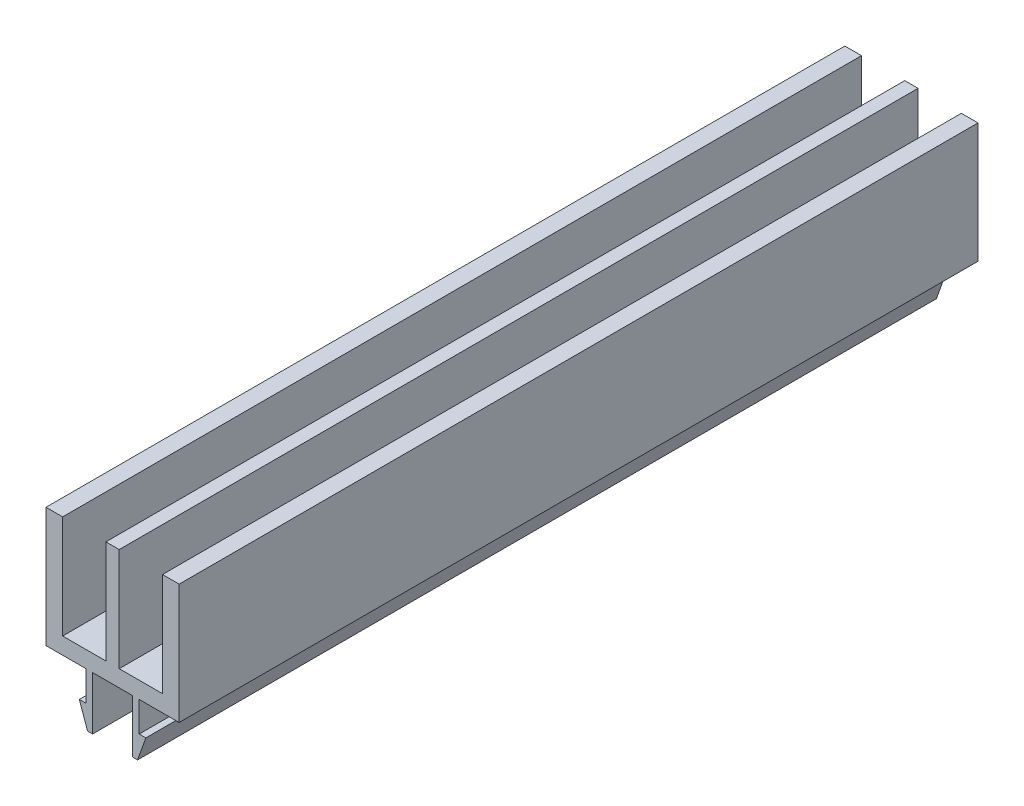
from build123d import *

# Parameters (mm, degrees)
BOSS_EXTRU_1_DEPTH = 120


with BuildPart() as part:
    # Esquisse1 → Boss.-Extru.1 (new body)
    with BuildSketch(Plane.XY.offset(50)):
        Polygon((-1, 2.5), (-7.5, 2.5), (-7.5, 17.999999998), (-10, 17.999999998), (-10, 0), (-4, 0), (-4, -4.5), (-5, -4.5), (-3.75, -8), (-3, -8), (-3, 0), (3, 0), (3, -8), (3.75, -8), (5, -4.5), (4, -4.5), (4, 0), (10, 0), (10, 17.999999998), (7.5, 17.999999998), (7.5, 2.5), (1, 2.5), (1, 17.999999998), (-1, 17.999999998), align=None)
    extrude(amount=-BOSS_EXTRU_1_DEPTH)


solid = part.part
